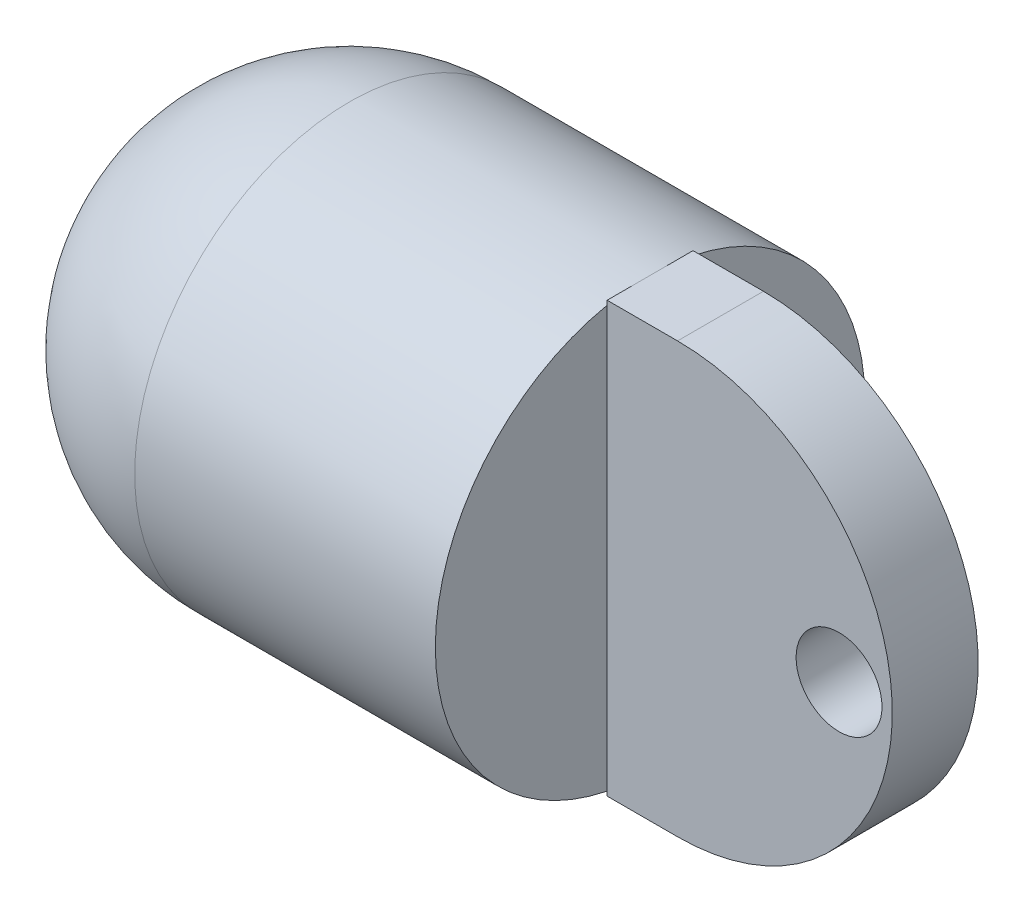
from build123d import *

# Parameters (mm, degrees)
SKETCH1_R               = 12.5
BOSS_EXTRUDE1_DEPTH     = 17.5
SKETCH6_W               = 5
SKETCH6_H               = 25
BOSS_EXTRUDE3_DEPTH     = 4.1
BOSS_EXTRUDE4_DEPTH     = 5
CUT_EXTRUDE1_DEPTH      = 27.220221204
CUT_EXTRUDE1_DEPTH_BACK = 27.220221204
SKETCH10_R              = 2.5
REVOLVE1_ANGLE          = 180


with BuildPart() as part:
    # Sketch1 → Boss-Extrude1 (new body)
    with BuildSketch(Plane(origin=(0, 0, 0), x_dir=(0, 0, -1), z_dir=(1, 0, 0))):
        Circle(SKETCH1_R)
    extrude(amount=-BOSS_EXTRUDE1_DEPTH)

    # Sketch6 → Boss-Extrude3 (add)
    with BuildSketch(Plane(origin=(0, 0, 0), x_dir=(0, 0, -1), z_dir=(1, 0, 0))):
        Rectangle(SKETCH6_W, SKETCH6_H)
    extrude(amount=BOSS_EXTRUDE3_DEPTH)

    # Sketch8 → Boss-Extrude4 (add)
    with BuildSketch(Plane.XY.offset(2.5)):
        with BuildLine():
            Line((4.1, 12.5), (4.1, -12.5))
            ThreePointArc((4.1, -12.5), (16.6, 0), (4.1, 12.5))
        make_face()
    extrude(amount=-BOSS_EXTRUDE4_DEPTH)

    # Sketch10 → Cut-Extrude1 (cut, two sides: drawn at the far end of the back side and taken through both)
    with BuildSketch(Plane.XY.offset(2.5).offset(-CUT_EXTRUDE1_DEPTH_BACK)):
        with Locations(Location((13.5, 0, 0), (0, 0, 270))):
            Circle(SKETCH10_R)
    extrude(amount=CUT_EXTRUDE1_DEPTH + CUT_EXTRUDE1_DEPTH_BACK, mode=Mode.SUBTRACT)

    # Sketch11 → Revolve1 (revolve)
    with BuildSketch(Plane.ZY.offset(17.5)):
        with BuildLine():
            Line((0, 12.5), (0, -12.5))
            ThreePointArc((0, -12.5), (12.5, 0), (0, 12.5))
        make_face()
    revolve(axis=Axis((-17.5, 12.5, 0), (0, -1, 0)), revolution_arc=REVOLVE1_ANGLE)


solid = part.part
